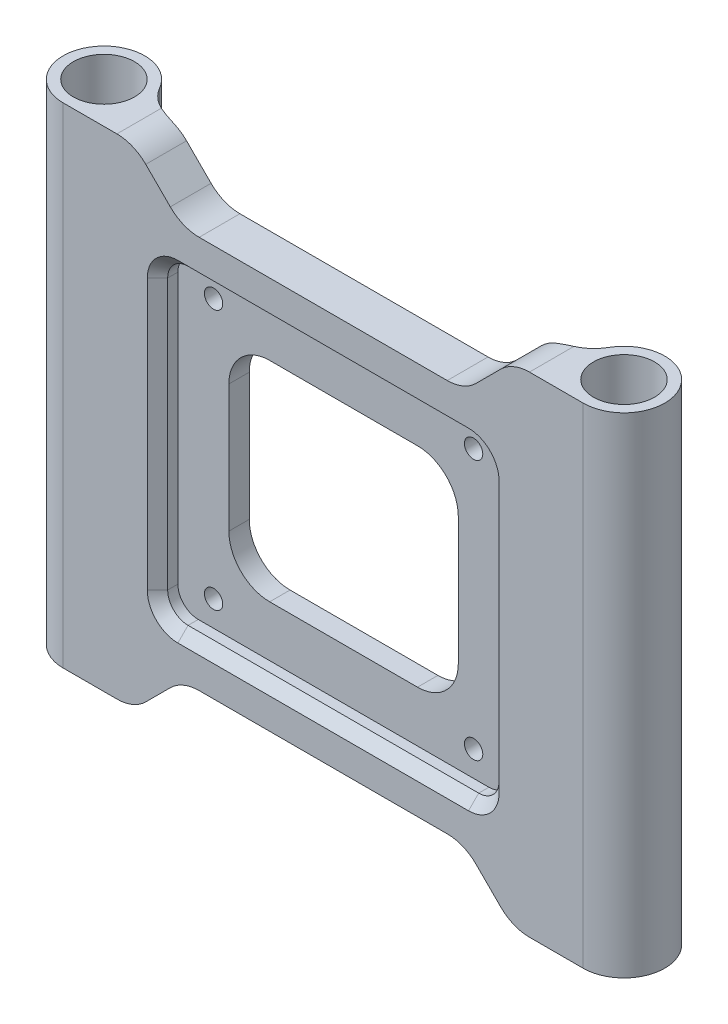
from build123d import *

# Parameters (mm, degrees)
BOSS_EXTRUDE1_DEPTH    = 24
F_6_0MM_DOWEL_HOLE1_D  = 6
SKETCH4_W              = 32.5
SKETCH4_H              = 30.5
CUT_EXTRUDE1_DEPTH     = 2
FILLET1_R              = 2
CUT_EXTRUDE2_DEPTH     = 57.482298112
FILLET2_R              = 4
SKETCH6_W              = 22.5
SKETCH6_H              = 20.5
CUT_EXTRUDE5_DEPTH     = 39.861935104
FILLET3_R              = 4
CUT_EXTRUDE6_DEPTH     = 39.861935104
FILLET4_R              = 4
M1_6_CLEARANCE_HOLE1_D = 1.8
CHAMFER1_SIZE          = 1


with BuildPart() as part:
    # Sketch1 → Boss-Extrude1 (new, symmetric)
    with BuildSketch(Plane(origin=(0, 0, 0), x_dir=(1, 0, 0), z_dir=(0, 1, 0))):
        with BuildLine():
            Line((25.5, 4), (-25.5, 4))
            ThreePointArc((-25.5, 4), (-29.5, 0), (-25.5, -4))
            Line((-25.5, -4), (25.5, -4))
            ThreePointArc((25.5, -4), (29.5, 0), (25.5, 4))
        make_face()
    extrude(amount=BOSS_EXTRUDE1_DEPTH, both=True)

    # Ø6.0mm Dowel Hole1 (through all)
    with Locations(Plane(origin=(0, -24, 0), x_dir=(-1, 0, 0), z_dir=(0, -1, 0))):
        with Locations((25.5, 0), (-25.5, 0)):
            Hole(F_6_0MM_DOWEL_HOLE1_D / 2)

    # Sketch4 → Cut-Extrude1 (cut)
    with BuildSketch(Plane(origin=(0, 0, 4), x_dir=(-1, 0, 0), z_dir=(0, 0, -1))):
        Rectangle(SKETCH4_W, SKETCH4_H)
    extrude(amount=CUT_EXTRUDE1_DEPTH, mode=Mode.SUBTRACT)

    # Fillet1
    fillet1_edges = [part.edges().sort_by_distance(p)[0] for p in [
        (-16.25, 15.25, 3),
        (16.25, 15.25, 3),
        (16.25, -15.25, 3),
        (-16.25, -15.25, 3),
    ]]
    fillet(fillet1_edges, radius=FILLET1_R)

    # Sketch5 → Cut-Extrude2 (cut, through all)
    with BuildSketch(Plane.XZ.offset(24)):
        with BuildLine():
            Line((21.5, 0), (-21.5, 0))
            ThreePointArc((-21.5, 0), (-22.671572875, -2.828427125), (-25.5, -4))
            Line((-25.5, -4), (25.5, -4))
            ThreePointArc((25.5, -4), (22.671572875, -2.828427125), (21.5, 0))
        make_face()
    extrude(amount=-CUT_EXTRUDE2_DEPTH, mode=Mode.SUBTRACT)

    # Fillet2
    fillet2_edges = [part.edges().sort_by_distance(p)[0] for p in [
        (21.5, 0, 0),
        (-21.5, 0, 0),
    ]]
    fillet(fillet2_edges, radius=FILLET2_R)

    # Sketch6 → Cut-Extrude5 (cut, through all)
    with BuildSketch(Plane.XY.offset(4)):
        Rectangle(SKETCH6_W, SKETCH6_H)
    extrude(amount=-CUT_EXTRUDE5_DEPTH, mode=Mode.SUBTRACT)

    # Fillet3
    fillet3_edges = [part.edges().sort_by_distance(p)[0] for p in [
        (11.25, -10.25, 1),
        (-11.25, -10.25, 1),
        (-11.25, 10.25, 1),
        (11.25, 10.25, 1),
    ]]
    fillet(fillet3_edges, radius=FILLET3_R)

    # Sketch7 → Cut-Extrude6 (cut, through all)
    with BuildSketch(Plane.XY.offset(4)):
        Polygon((18.57179677, 24), (-18.57179677, 24), (-13.82179677, 19.25), (13.82179677, 19.25), align=None)
        Polygon((-18.57179677, -24), (18.57179677, -24), (13.82179677, -19.25), (-13.82179677, -19.25), align=None)
    extrude(amount=-CUT_EXTRUDE6_DEPTH, mode=Mode.SUBTRACT)

    # Fillet4
    fillet4_edges = [part.edges().sort_by_distance(p)[0] for p in [
        (18.57179677, 24, 2),
        (13.82179677, 19.25, 2),
        (-13.82179677, 19.25, 2),
        (-18.57179677, 24, 2),
        (-18.57179677, -24, 2),
        (-13.82179677, -19.25, 2),
        (13.82179677, -19.25, 2),
        (18.57179677, -24, 2),
    ]]
    fillet(fillet4_edges, radius=FILLET4_R)

    # M1.6 Clearance Hole1 (through all)
    with Locations(Plane(origin=(0, 0, 0), x_dir=(-1, 0, 0), z_dir=(0, 0, -1))):
        with Locations((12.75, 12.75), (-12.75, 12.75), (-12.75, -12.75), (12.75, -12.75)):
            Hole(M1_6_CLEARANCE_HOLE1_D / 2)

    # Chamfer1
    chamfer1_edges = [part.edges().sort_by_distance(p)[0] for p in [
        (16.25, 0, 4),
        (0, -15.25, 4),
        (-16.25, 0, 4),
        (0, 15.25, 4),
        (15.664213562, -14.664213562, 4),
        (-15.664213562, 14.664213562, 4),
        (15.664213562, 14.664213562, 4),
        (-15.664213562, -14.664213562, 4),
    ]]
    chamfer(chamfer1_edges, length=CHAMFER1_SIZE)


solid = part.part
